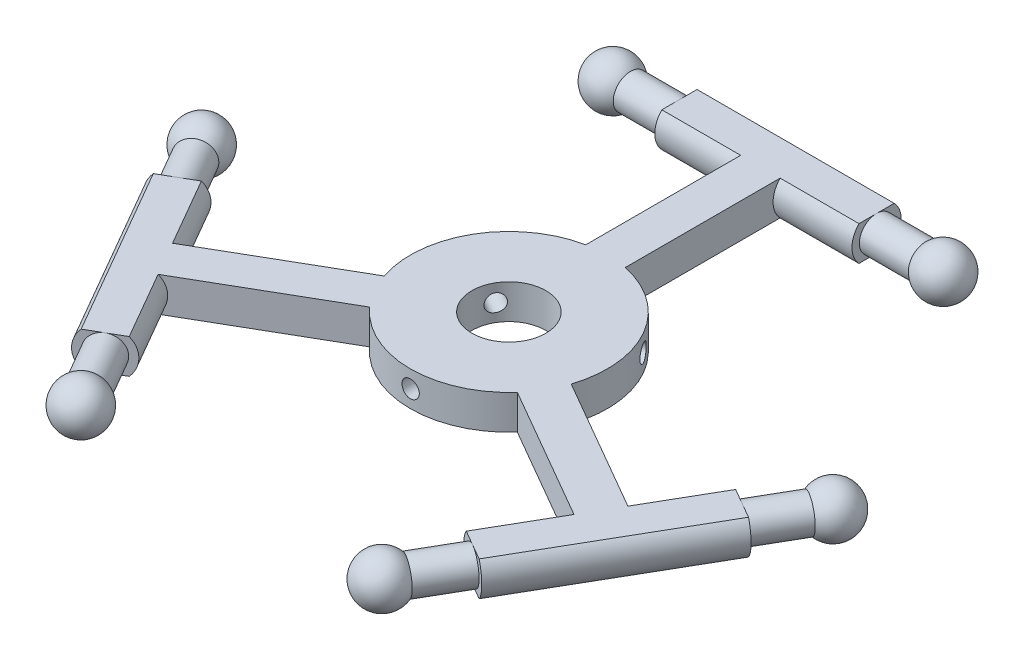
from build123d import *

# Parameters (mm, degrees)
SKETCH1_R           = 7.5
BOSS_EXTRUDE1_DEPTH = 7
BOSS_EXTRUDE2_DEPTH = 20
CUT_EXTRUDE1_DEPTH  = 20
CIRPATTERN1_COUNT   = 3
CUT_EXTRUDE2_REACH  = 99.682
SKETCH3_R           = 1.75
CIRPATTERN2_COUNT   = 3
SKETCH4_R           = 3.5
BOSS_EXTRUDE3_DEPTH = 13.5
BOSS_EXTRUDE4_START = 13.5
SKETCH5_R           = 3.5
BOSS_EXTRUDE4_DEPTH = 13.5
CIRPATTERN3_COUNT   = 3
CIRPATTERN4_COUNT   = 3


with BuildPart() as part:
    # Sketch1 → Boss-Extrude1 (new body)
    with BuildSketch(Plane(origin=(0, 0, 0), x_dir=(1, 0, 0), z_dir=(0, 1, 0))):
        with BuildLine():
            Line((18.970562748, -6.333857356), (49.281451881, -23.833857356))
            Line((49.281451881, -23.833857356), (45.281451881, -30.762060586))
            Line((45.281451881, -30.762060586), (14.970562748, -13.262060586))
            ThreePointArc((14.970562748, -13.262060586), (0, -20), (-14.970562748, -13.262060586))
            Line((-14.970562748, -13.262060586), (-45.281451881, -30.762060586))
            Line((-45.281451881, -30.762060586), (-49.281451881, -23.833857356))
            Line((-49.281451881, -23.833857356), (-18.970562748, -6.333857356))
            ThreePointArc((-18.970562748, -6.333857356), (-17.320508076, 10), (-4, 19.595917942))
            Line((-4, 19.595917942), (-4, 54.595917942))
            Line((-4, 54.595917942), (4, 54.595917942))
            Line((4, 54.595917942), (4, 19.595917942))
            ThreePointArc((4, 19.595917942), (17.320508076, 10), (18.970562748, -6.333857356))
        make_face()
        Circle(SKETCH1_R, mode=Mode.SUBTRACT)
    extrude(amount=BOSS_EXTRUDE1_DEPTH)

    # Sketch2 → Boss-Extrude2 (add, symmetric)
    with BuildSketch(Plane(origin=(0, 0, 0), x_dir=(0, 0, -1), z_dir=(1, 0, 0))):
        with BuildLine():
            Line((51.025203728, 7), (58.166632157, 7))
            ThreePointArc((58.166632157, 7), (59.595917942, 3.5), (58.166632157, 0))
            Line((58.166632157, 0), (51.025203728, 0))
            ThreePointArc((51.025203728, 0), (49.595917942, 3.5), (51.025203728, 7))
        make_face()
        with BuildLine():
            Line((52.970917942, 5.718529919), (56.220917942, 5.718529919))
            ThreePointArc((56.220917942, 5.718529919), (54.595917942, 0.75), (52.970917942, 5.718529919))
        make_face(mode=Mode.SUBTRACT)
    boss_extrude2 = extrude(amount=BOSS_EXTRUDE2_DEPTH, both=True)

    # Sketch2<2> → Cut-Extrude1 (cut, symmetric)
    with BuildSketch(Plane(origin=(0, 0, 0), x_dir=(0, 0, -1), z_dir=(1, 0, 0))):
        with BuildLine():
            Line((56.220917942, 5.718529919), (52.970917942, 5.718529919))
            ThreePointArc((52.970917942, 5.718529919), (54.595917942, 0.75), (56.220917942, 5.718529919))
        make_face()
    cut_extrude1 = extrude(amount=CUT_EXTRUDE1_DEPTH, both=True, mode=Mode.SUBTRACT)

    # CirPattern1: Boss-Extrude2, Cut-Extrude1 ×3 about axis
    cirpattern1_axis = Axis((0, 7, 0), (0, 1, 0))
    add([boss_extrude2.rotate(cirpattern1_axis, i * 360 / CIRPATTERN1_COUNT) for i in range(1, CIRPATTERN1_COUNT)])
    add([cut_extrude1.rotate(cirpattern1_axis, i * 360 / CIRPATTERN1_COUNT) for i in range(1, CIRPATTERN1_COUNT)], mode=Mode.SUBTRACT)

    # Sketch3 → Cut-Extrude2 (cut, up to next)
    with BuildSketch(Plane(origin=(17.320508076, 0, -10), x_dir=(0, -1, 0), z_dir=(0.8660254037844398, 0, -0.499999999999998)), mode=Mode.PRIVATE) as cut_extrude2_sk1:
        with Locations((-3.5, 0)):
            Circle(SKETCH3_R)
    cut_extrude2_tool1 = extrude(cut_extrude2_sk1.sketch, amount=-CUT_EXTRUDE2_REACH, mode=Mode.PRIVATE) & part.part
    cut_extrude2 = cut_extrude2_tool1.solids().sort_by_distance((17.320508, 3.5, -10))[0]
    add(cut_extrude2, mode=Mode.SUBTRACT)

    # CirPattern2: Cut-Extrude2 ×3 about axis
    cirpattern2_axis = Axis((0, 7, 0), (0, 1, 0))
    for i in range(1, CIRPATTERN2_COUNT):
        add(cut_extrude2.rotate(cirpattern2_axis, i * 360 / CIRPATTERN2_COUNT), mode=Mode.SUBTRACT)

    # Sketch4 → Boss-Extrude3 (add)
    with BuildSketch(Plane(origin=(20, 0, 0), x_dir=(0, 0, -1), z_dir=(1, 0, 0))):
        with Locations((54.595917942, 3.5)):
            Circle(SKETCH4_R)
    boss_extrude3 = extrude(amount=BOSS_EXTRUDE3_DEPTH)

    # Sketch5 → Boss-Extrude4 (add)
    with BuildSketch(Plane.ZY.offset(20).offset(BOSS_EXTRUDE4_START)):
        with Locations((-54.595917942, 3.5)):
            Circle(SKETCH5_R)
    boss_extrude4 = extrude(amount=-BOSS_EXTRUDE4_DEPTH)

    # CirPattern3: Boss-Extrude3, Boss-Extrude4 ×3 about axis
    cirpattern3_axis = Axis((0, 7, 0), (0, -1, 0))
    add([boss_extrude3.rotate(cirpattern3_axis, i * 360 / CIRPATTERN3_COUNT) for i in range(1, CIRPATTERN3_COUNT)])
    add([boss_extrude4.rotate(cirpattern3_axis, i * 360 / CIRPATTERN3_COUNT) for i in range(1, CIRPATTERN3_COUNT)])

    # Sketch6 → Revolve1 (revolve)
    with BuildSketch(Plane.ZY.offset(33.5)):
        with BuildLine():
            Line((-54.595917942, 8.5), (-54.595917942, -1.5))
            ThreePointArc((-54.595917942, -1.5), (-59.595917942, 3.5), (-54.595917942, 8.5))
        make_face()
    revolve1 = revolve(axis=Axis((-33.5, 8.5, -54.595917942), (0, -1, 0)))

    # Sketch7 → Revolve2 (revolve)
    with BuildSketch(Plane(origin=(33.5, 0, 0), x_dir=(0, 0, -1), z_dir=(1, 0, 0))):
        with BuildLine():
            Line((54.595917942, 8.5), (54.595917942, -1.5))
            ThreePointArc((54.595917942, -1.5), (59.595917942, 3.5), (54.595917942, 8.5))
        make_face()
    revolve2 = revolve(axis=Axis((33.5, 8.5, -54.595917942), (0, -1, 0)))

    # CirPattern4: Revolve1, Revolve2 ×3 about axis
    cirpattern4_axis = Axis((0, 7, 0), (0, -1, 0))
    add([revolve1.rotate(cirpattern4_axis, i * 360 / CIRPATTERN4_COUNT) for i in range(1, CIRPATTERN4_COUNT)])
    add([revolve2.rotate(cirpattern4_axis, i * 360 / CIRPATTERN4_COUNT) for i in range(1, CIRPATTERN4_COUNT)])


solid = part.part
